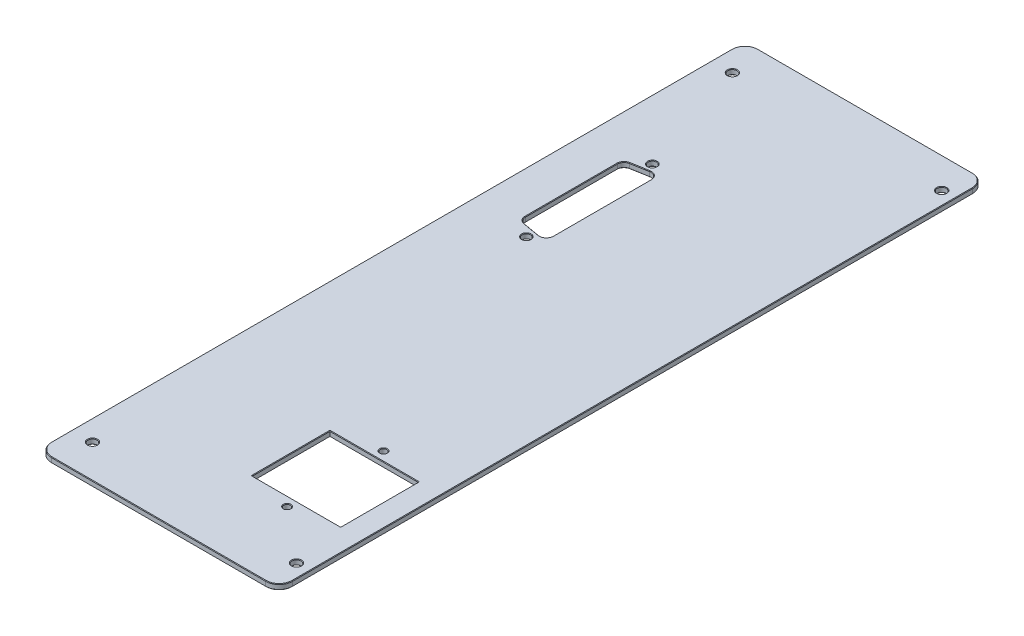
from build123d import *

# Parameters (mm, degrees)
ESQUISSE1_W             = 90
ESQUISSE1_H             = 2
BASE_EXTRUSION_DEPTH    = 264
ESQUISSE2_W             = 33
ESQUISSE2_H             = 29
ENL_V_MAT_EXTRU_1_DEPTH = 279.92651362
ENL_V_MAT_EXTRU_2_DEPTH = 279.92651362
ESQUISSE4_R             = 1.6
ESQUISSE4_R_2           = 1.7
ESQUISSE4_R_3           = 1.25
ENL_V_MAT_EXTRU_3_DEPTH = 279.92651362
CONG_1_R                = 5
CHANFREIN1_SIZE         = 0.2


with BuildPart() as part:
    # Esquisse1 → Base-Extrusion (new body)
    with BuildSketch(Plane.XY):
        with Locations((45, 1)):
            Rectangle(ESQUISSE1_W, ESQUISSE1_H)
    extrude(amount=BASE_EXTRUSION_DEPTH)

    # Esquisse2 → Enlèv. mat.-Extru.1 (cut, through all)
    with BuildSketch(Plane(origin=(0, 2, 0), x_dir=(-1, 0, 0), z_dir=(0, 1, 0))):
        with Locations((-65, 218)):
            Rectangle(ESQUISSE2_W, ESQUISSE2_H)
    extrude(amount=-ENL_V_MAT_EXTRU_1_DEPTH, mode=Mode.SUBTRACT)

    # Esquisse3 → Enlèv. mat.-Extru.2 (cut, through all)
    with BuildSketch(Plane(origin=(0, 2, 0), x_dir=(-1, 0, 0), z_dir=(0, 1, 0))):
        with BuildLine():
            Line((-27.1, 98.770616019), (-27.1, 62.229383981))
            ThreePointArc((-27.1, 62.229383981), (-26.206969024, 60.314272874), (-24.165879556, 59.767364599))
            Line((-24.165879556, 59.767364599), (-17.765879556, 60.895857275))
            ThreePointArc((-17.765879556, 60.895857275), (-16.284888892, 61.750907634), (-15.7, 63.357876658))
            Line((-15.7, 63.357876658), (-15.7, 97.642123342))
            ThreePointArc((-15.7, 97.642123342), (-16.284888892, 99.249092366), (-17.765879556, 100.104142725))
            Line((-17.765879556, 100.104142725), (-24.165879556, 101.232635401))
            ThreePointArc((-24.165879556, 101.232635401), (-26.206969024, 100.685727126), (-27.1, 98.770616019))
        make_face()
    extrude(amount=-ENL_V_MAT_EXTRU_2_DEPTH, mode=Mode.SUBTRACT)

    # Esquisse4 → Enlèv. mat.-Extru.3 (cut, through all)
    with BuildSketch(Plane(origin=(0, 2, 0), x_dir=(-1, 0, 0), z_dir=(0, 1, 0))):
        with Locations(Location((-22.4, 104.02, 0), (0, 0, 270))):
            Circle(ESQUISSE4_R)
        with Locations(Location((-22.4, 56.98, 0), (0, 0, 270))):
            Circle(ESQUISSE4_R)
        with Locations(Location((-85, 252.5, 0), (0, 0, 270))):
            Circle(ESQUISSE4_R_2)
        with Locations(Location((-85, 11.5, 0), (0, 0, 270))):
            Circle(ESQUISSE4_R_2)
        with Locations(Location((-7.82, 12.49, 0), (0, 0, 270))):
            Circle(ESQUISSE4_R_2)
        with Locations(Location((-7.82, 251.51, 0), (0, 0, 270))):
            Circle(ESQUISSE4_R_2)
        with Locations(Location((-65, 236, 0), (0, 0, 270))):
            Circle(ESQUISSE4_R_3)
        with Locations(Location((-65, 200, 0), (0, 0, 270))):
            Circle(ESQUISSE4_R_3)
    extrude(amount=-ENL_V_MAT_EXTRU_3_DEPTH, mode=Mode.SUBTRACT)

    # Congé1
    cong_1_edges = [part.edges().sort_by_distance(p)[0] for p in [
        (0, 1, 0),
        (0, 1, 264),
        (90, 1, 0),
        (90, 1, 264),
    ]]
    fillet(cong_1_edges, radius=CONG_1_R)

    # Chanfrein1
    chanfrein1_edges = [part.edges().sort_by_distance(p)[0] for p in [
        (0, 0, 132),
        (1.464466094, 0, 1.464466094),
        (1.464466094, 0, 262.535533906),
        (45, 0, 0),
        (45, 0, 264),
        (88.535533906, 0, 1.464466094),
        (88.535533906, 0, 262.535533906),
        (90, 0, 132),
        (7.82, 0, 253.21),
        (65, 0, 237.25),
        (81.5, 0, 218),
        (65, 0, 203.5),
        (65, 0, 232.5),
        (48.5, 0, 218),
        (65, 0, 201.25),
        (85, 0, 254.2),
        (22.4, 0, 105.62),
        (27.1, 0, 80.5),
        (26.206969024, 0, 100.685727126),
        (26.206969024, 0, 60.314272874),
        (20.965879556, 0, 100.668389063),
        (20.965879556, 0, 60.331610937),
        (16.284888892, 0, 99.249092366),
        (16.284888892, 0, 61.750907634),
        (15.7, 0, 80.5),
        (22.4, 0, 58.58),
        (7.82, 0, 14.19),
        (85, 0, 13.2),
        (0, 2, 132),
        (1.464466094, 2, 1.464466094),
        (1.464466094, 2, 262.535533906),
        (45, 2, 0),
        (45, 2, 264),
        (88.535533906, 2, 1.464466094),
        (88.535533906, 2, 262.535533906),
        (90, 2, 132),
        (7.82, 2, 253.21),
        (65, 2, 237.25),
        (81.5, 2, 218),
        (65, 2, 203.5),
        (65, 2, 232.5),
        (48.5, 2, 218),
        (65, 2, 201.25),
        (85, 2, 254.2),
        (22.4, 2, 105.62),
        (27.1, 2, 80.5),
        (26.206969024, 2, 100.685727126),
        (26.206969024, 2, 60.314272874),
        (20.965879556, 2, 100.668389063),
        (20.965879556, 2, 60.331610937),
        (16.284888892, 2, 99.249092366),
        (16.284888892, 2, 61.750907634),
        (15.7, 2, 80.5),
        (22.4, 2, 58.58),
        (7.82, 2, 14.19),
        (85, 2, 13.2),
    ]]
    chamfer(chanfrein1_edges, length=CHANFREIN1_SIZE)


solid = part.part
